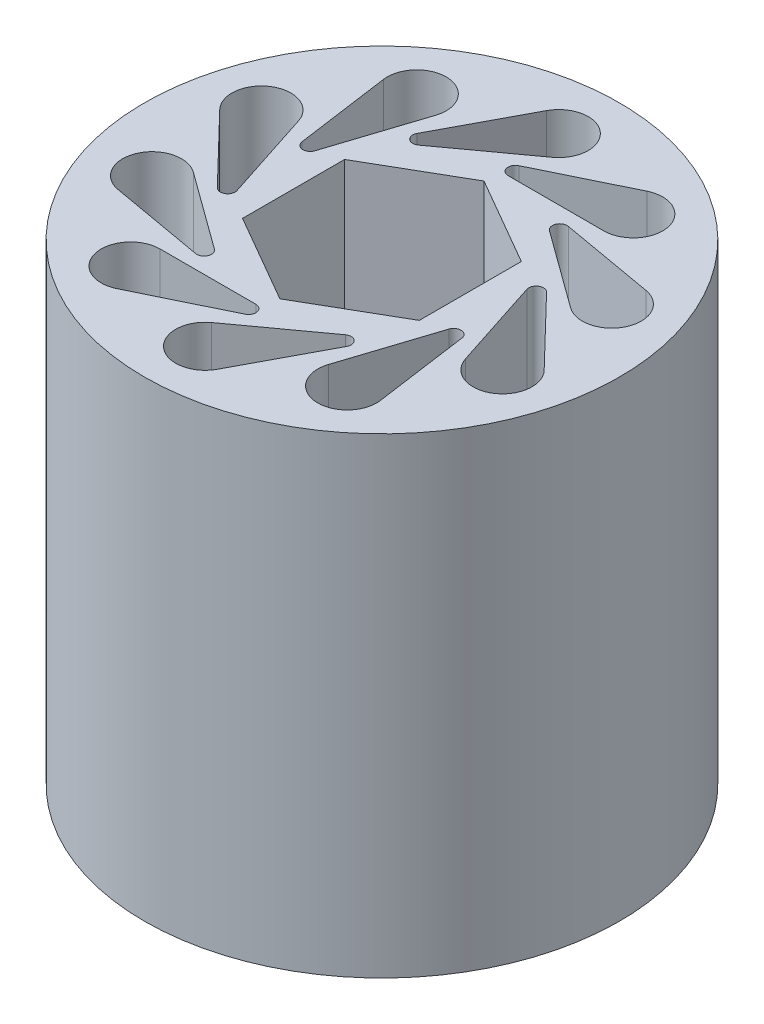
from build123d import *

# Parameters (mm, degrees)
SKETCH1_R           = 25.6
BOSS_EXTRUDE1_DEPTH = 50.8
CHAMFER1_SIZE       = 0.2


with BuildPart() as part:
    # Sketch1 → Boss-Extrude1 (new body)
    with BuildSketch(Plane(origin=(0, 0, 0), x_dir=(1, 0, 0), z_dir=(0, 1, 0))):
        with Locations(Location((0, 0, 0), (0, 0, 270))):
            Circle(SKETCH1_R)
        with BuildLine():
            Line((0.445926966, 14.307233146), (9.721207865, 18.828932584))
            ThreePointArc((9.721207865, 18.828932584), (14.206192046, 16.688928934), (11.1125, 12.8))
            Line((11.1125, 12.8), (0.79375, 12.8))
            ThreePointArc((0.79375, 12.8), (0.020326988, 13.415267767), (0.445926966, 14.307233146))
        make_face(mode=Mode.SUBTRACT)
        with BuildLine():
            Line((8.770343138, 11.312685463), (18.931991258, 9.518943829))
            ThreePointArc((18.931991258, 9.518943829), (21.302557095, 5.151436949), (16.513852579, 3.823653912))
            Line((16.513852579, 3.823653912), (8.165808469, 9.888862984))
            ThreePointArc((8.165808469, 9.888862984), (7.901741428, 10.841231703), (8.770343138, 11.312685463))
        make_face(mode=Mode.SUBTRACT)
        with BuildLine():
            Line((13.744786325, 3.997076438), (20.911397465, -3.426957932))
            ThreePointArc((20.911397465, -3.426957932), (20.26206938, -8.353728859), (15.607474759, -6.613198009))
            Line((15.607474759, -6.613198009), (12.418805648, 3.200516418))
            ThreePointArc((12.418805648, 3.200516418), (12.764959212, 4.126213609), (13.744786325, 3.997076438))
        make_face(mode=Mode.SUBTRACT)
        with BuildLine():
            Line((13.469188303, -4.845279932), (14.903360593, -15.063878241))
            ThreePointArc((14.903360593, -15.063878241), (11.482159845, -18.668054176), (8.739572059, -14.524033065))
            Line((8.739572059, -14.524033065), (11.928241169, -4.710318638))
            ThreePointArc((11.928241169, -4.710318638), (12.752396442, -4.164877839), (13.469188303, -4.845279932))
        make_face(mode=Mode.SUBTRACT)
        with BuildLine():
            Line((8.04881815, -11.836904052), (3.202746521, -20.946909064))
            ThreePointArc((3.202746521, -20.946909064), (-1.683544487, -21.851817301), (-1.466550121, -16.887181144))
            Line((-1.466550121, -16.887181144), (6.88149399, -10.821972072))
            ThreePointArc((6.88149399, -10.821972072), (7.86885167, -10.865127511), (8.04881815, -11.836904052))
        make_face(mode=Mode.SUBTRACT)
        with BuildLine():
            Line((-0.445926966, -14.307233146), (-9.721207865, -18.828932584))
            ThreePointArc((-9.721207865, -18.828932584), (-14.206192046, -16.688928934), (-11.1125, -12.8))
            Line((-11.1125, -12.8), (-0.79375, -12.8))
            ThreePointArc((-0.79375, -12.8), (-0.020326988, -13.415267767), (-0.445926966, -14.307233146))
        make_face(mode=Mode.SUBTRACT)
        with BuildLine():
            Line((-8.770343138, -11.312685463), (-18.931991258, -9.518943829))
            ThreePointArc((-18.931991258, -9.518943829), (-21.302557095, -5.151436949), (-16.513852579, -3.823653912))
            Line((-16.513852579, -3.823653912), (-8.165808469, -9.888862984))
            ThreePointArc((-8.165808469, -9.888862984), (-7.901741428, -10.841231703), (-8.770343138, -11.312685463))
        make_face(mode=Mode.SUBTRACT)
        with BuildLine():
            Line((-13.744786325, -3.997076438), (-20.911397465, 3.426957932))
            ThreePointArc((-20.911397465, 3.426957932), (-20.26206938, 8.353728859), (-15.607474759, 6.613198009))
            Line((-15.607474759, 6.613198009), (-12.418805648, -3.200516418))
            ThreePointArc((-12.418805648, -3.200516418), (-12.764959212, -4.126213609), (-13.744786325, -3.997076438))
        make_face(mode=Mode.SUBTRACT)
        with BuildLine():
            Line((-13.469188303, 4.845279932), (-14.903360593, 15.063878241))
            ThreePointArc((-14.903360593, 15.063878241), (-11.482159845, 18.668054176), (-8.739572059, 14.524033065))
            Line((-8.739572059, 14.524033065), (-11.928241169, 4.710318638))
            ThreePointArc((-11.928241169, 4.710318638), (-12.752396442, 4.164877839), (-13.469188303, 4.845279932))
        make_face(mode=Mode.SUBTRACT)
        with BuildLine():
            Line((-8.04881815, 11.836904052), (-3.202746521, 20.946909064))
            ThreePointArc((-3.202746521, 20.946909064), (1.683544487, 21.851817301), (1.466550121, 16.887181144))
            Line((1.466550121, 16.887181144), (-6.88149399, 10.821972072))
            ThreePointArc((-6.88149399, 10.821972072), (-7.86885167, 10.865127511), (-8.04881815, 11.836904052))
        make_face(mode=Mode.SUBTRACT)
        Polygon((0, 10.998522628), (-9.525, 5.499261314), (-9.525, -5.499261314), (0, -10.998522628), (9.525, -5.499261314), (9.525, 5.499261314), align=None, mode=Mode.SUBTRACT)
    extrude(amount=BOSS_EXTRUDE1_DEPTH)

    # Chamfer1
    chamfer1_edges = [part.edges().sort_by_distance(p)[0] for p in [
        (-4.7625, 0, -8.248891971),
        (-9.525, 0, 0),
        (-4.7625, 0, 8.248891971),
        (4.7625, 0, 8.248891971),
        (9.525, 0, 0),
        (4.7625, 0, -8.248891971),
    ]]
    chamfer(chamfer1_edges, length=CHAMFER1_SIZE)


solid = part.part
